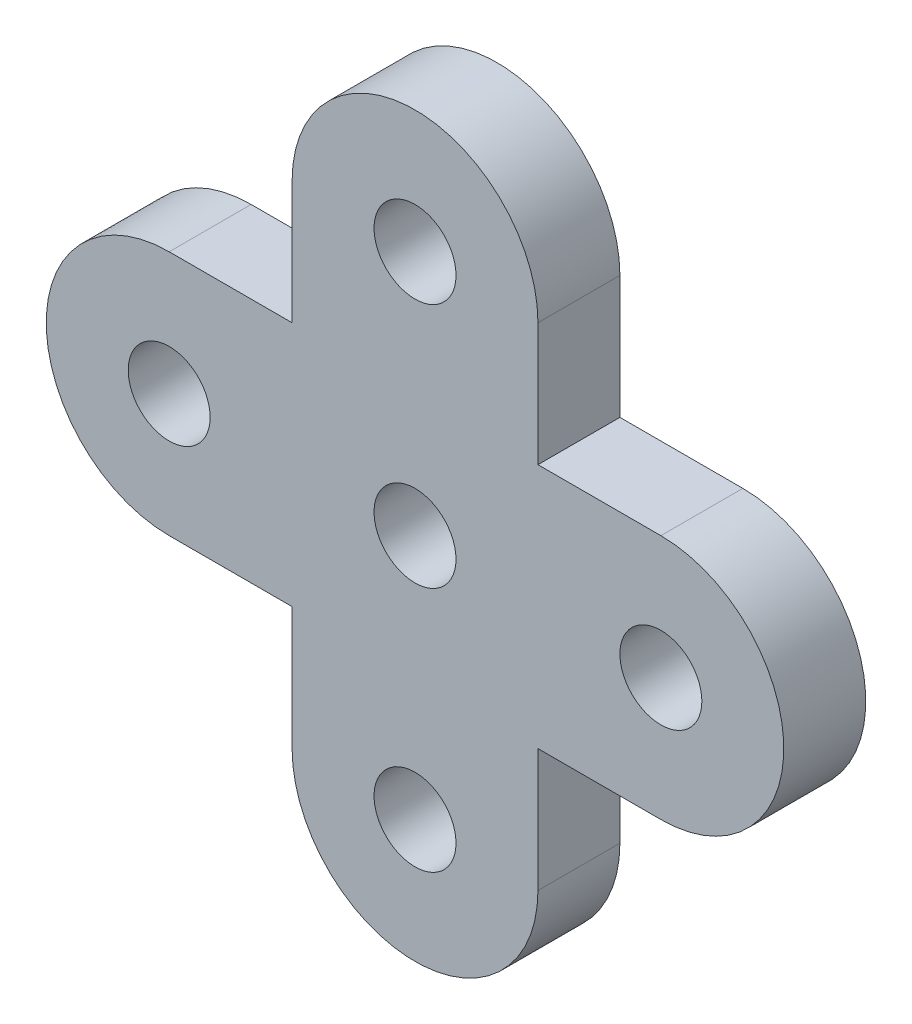
from build123d import *

# Parameters (mm, degrees)
MODEL_R                 = 1.5
SALIENTE_EXTRUIR1_DEPTH = 3


with BuildPart() as part:
    # Model → Saliente-Extruir1 (new body)
    with BuildSketch(Plane.XY):
        with BuildLine():
            Line((213.25077615, 165.928489513), (213.25077615, 170.428489513))
            ThreePointArc((213.25077615, 170.428489513), (208.75077615, 174.928489513), (204.25077615, 170.428489513))
            Line((204.25077615, 170.428489513), (204.25077615, 165.928489513))
            Line((204.25077615, 165.928489513), (199.75077615, 165.928489513))
            ThreePointArc((199.75077615, 165.928489513), (195.25077615, 161.428489513), (199.75077615, 156.928489513))
            Line((199.75077615, 156.928489513), (204.25077615, 156.928489513))
            Line((204.25077615, 156.928489513), (204.25077615, 152.428489513))
            ThreePointArc((204.25077615, 152.428489513), (208.75077615, 147.928489513), (213.25077615, 152.428489513))
            Line((213.25077615, 152.428489513), (213.25077615, 156.928489513))
            Line((213.25077615, 156.928489513), (217.75077615, 156.928489513))
            ThreePointArc((217.75077615, 156.928489513), (222.25077615, 161.428489513), (217.75077615, 165.928489513))
            Line((217.75077615, 165.928489513), (213.25077615, 165.928489513))
        make_face()
        with Locations((208.75077615, 152.428489513)):
            Circle(MODEL_R, mode=Mode.SUBTRACT)
        with Locations((208.75077615, 161.428489513)):
            Circle(MODEL_R, mode=Mode.SUBTRACT)
        with Locations((208.75077615, 170.428489513)):
            Circle(MODEL_R, mode=Mode.SUBTRACT)
        with Locations((199.75077615, 161.428489513)):
            Circle(MODEL_R, mode=Mode.SUBTRACT)
        with Locations((217.75077615, 161.428489513)):
            Circle(MODEL_R, mode=Mode.SUBTRACT)
    extrude(amount=SALIENTE_EXTRUIR1_DEPTH)


solid = part.part
